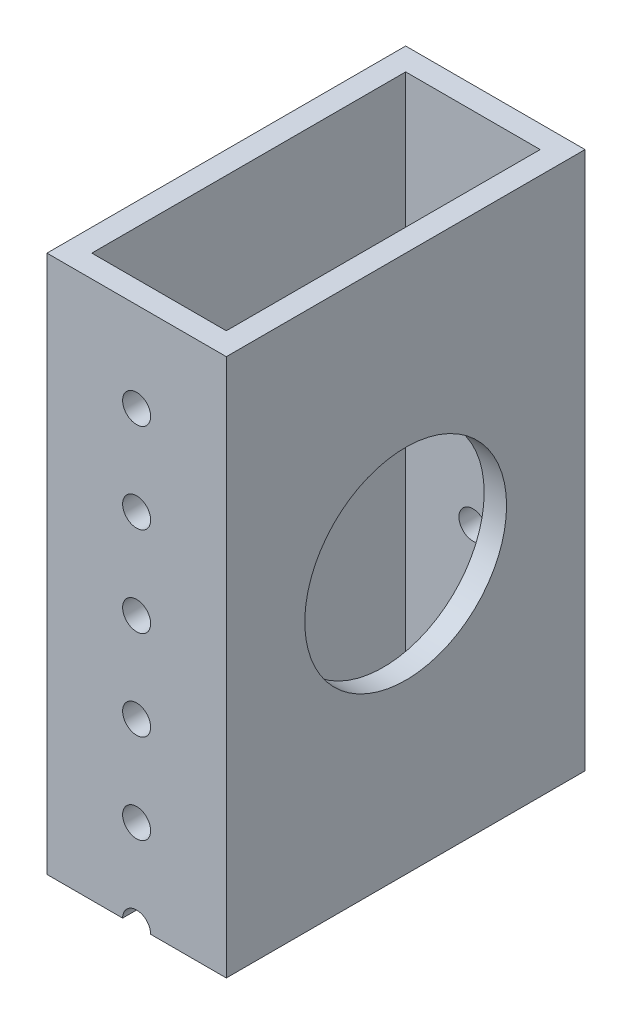
from build123d import *

# Parameters (mm, degrees)
SKETCH1_W                       = 25.4
SKETCH1_H                       = 50.8
SKETCH1_W_2                     = 19.05
SKETCH1_H_2                     = 44.45
BOSS_EXTRUDE1_DEPTH             = 38.1
F_5_32_0_15625_DIAMETER_HOLE1_D = 3.96875
SKETCH5_R                       = 14.2875
CUT_EXTRUDE1_DEPTH              = 53.363441445


with BuildPart() as part:
    # Sketch1 → Boss-Extrude1 (new, symmetric)
    with BuildSketch(Plane(origin=(0, 0, 0), x_dir=(1, 0, 0), z_dir=(0, 1, 0))):
        Rectangle(SKETCH1_W, SKETCH1_H)
        Rectangle(SKETCH1_W_2, SKETCH1_H_2, mode=Mode.SUBTRACT)
    extrude(amount=BOSS_EXTRUDE1_DEPTH, both=True)

    # 5/32 (0.15625) Diameter Hole1 (through all)
    with Locations(Plane(origin=(0, 0, -25.4), x_dir=(-1, 0, 0), z_dir=(0, 0, -1))):
        with Locations((0, 25.4), (0, 12.7), (0, 0), (0, -12.7), (0, -25.4), (0, -38.1), (0, -50.8), (0, -63.5), (0, -76.2), (0, -88.9), (0, -101.6), (0, -114.3), (0, -127), (0, -139.7), (0, -152.4), (0, -165.1), (0, -177.8), (0, -190.5), (0, -203.2), (0, -215.9), (0, -228.6), (0, -241.3), (0, -254), (0, -266.7), (0, -279.4), (0, -292.1), (0, -304.8), (0, -317.5), (0, -330.2), (0, -342.9), (0, -355.6), (0, -368.3), (0, -381), (0, -393.7), (0, -406.4), (0, -419.1), (0, -431.8), (0, -444.5), (0, -457.2), (0, -469.9), (0, -482.6), (0, -495.3), (0, -508), (0, -520.7), (0, -533.4), (0, -546.1), (0, -558.8), (0, -571.5), (0, -584.2), (0, -596.9), (0, -609.6), (0, -622.3), (0, -635), (0, -647.7), (0, -660.4), (0, -673.1), (0, -685.8), (0, -698.5), (0, -711.2), (0, -723.9), (0, -736.6), (0, -749.3), (0, -762), (0, -774.7), (0, -787.4), (0, -800.1), (0, -812.8), (0, -825.5), (0, -838.2)):
            Hole(F_5_32_0_15625_DIAMETER_HOLE1_D / 2)

    # Sketch5 → Cut-Extrude1 (cut, through all)
    with BuildSketch(Plane(origin=(12.7, 0, 0), x_dir=(0, 0, -1), z_dir=(1, 0, 0))):
        Circle(SKETCH5_R)
    extrude(amount=-CUT_EXTRUDE1_DEPTH, mode=Mode.SUBTRACT)


solid = part.part
